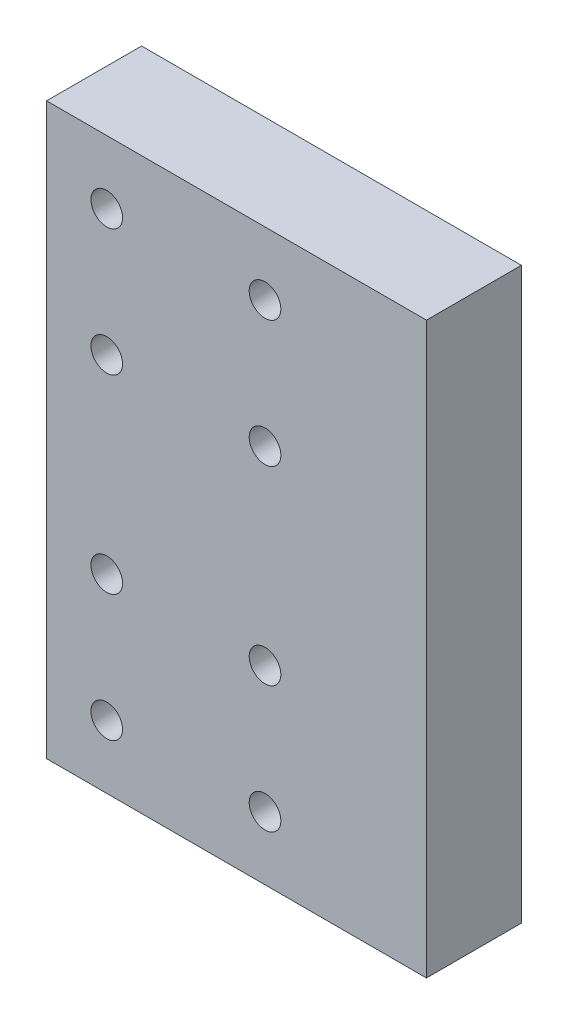
from build123d import *

# Parameters (mm, degrees)
ESQUISSE1_W                  = 60
ESQUISSE1_H                  = 90
BOSS_EXTRU_1_DEPTH           = 15
ENL_V_MAT_EXTRU_1_DEPTH      = 110.201648339
ENL_V_MAT_EXTRU_1_DEPTH_BACK = 110.201648339
ESQUISSE2_R                  = 2.5


with BuildPart() as part:
    # Esquisse1 → Boss.-Extru.1 (new body)
    with BuildSketch(Plane.XY):
        with Locations((30, 45)):
            Rectangle(ESQUISSE1_W, ESQUISSE1_H)
    extrude(amount=BOSS_EXTRU_1_DEPTH)

    # Esquisse2 → Enlèv. mat.-Extru.1 (cut, two sides: drawn at the far end of the back side and taken through both)
    with BuildSketch(Plane.XY.offset(15).offset(-ENL_V_MAT_EXTRU_1_DEPTH_BACK)):
        with Locations((9.5, 10)):
            Circle(ESQUISSE2_R)
        with Locations(Location((34.5, 10, 0), (0, 0, 180))):
            Circle(ESQUISSE2_R)
        with Locations((34.5, 30)):
            Circle(ESQUISSE2_R)
        with Locations(Location((9.5, 30, 0), (0, 0, 180))):
            Circle(ESQUISSE2_R)
        with Locations((9.5, 60)):
            Circle(ESQUISSE2_R)
        with Locations(Location((34.5, 60, 0), (0, 0, 180))):
            Circle(ESQUISSE2_R)
        with Locations((34.5, 80)):
            Circle(ESQUISSE2_R)
        with Locations(Location((9.5, 80, 0), (0, 0, 180))):
            Circle(ESQUISSE2_R)
    extrude(amount=ENL_V_MAT_EXTRU_1_DEPTH + ENL_V_MAT_EXTRU_1_DEPTH_BACK, mode=Mode.SUBTRACT)


solid = part.part
